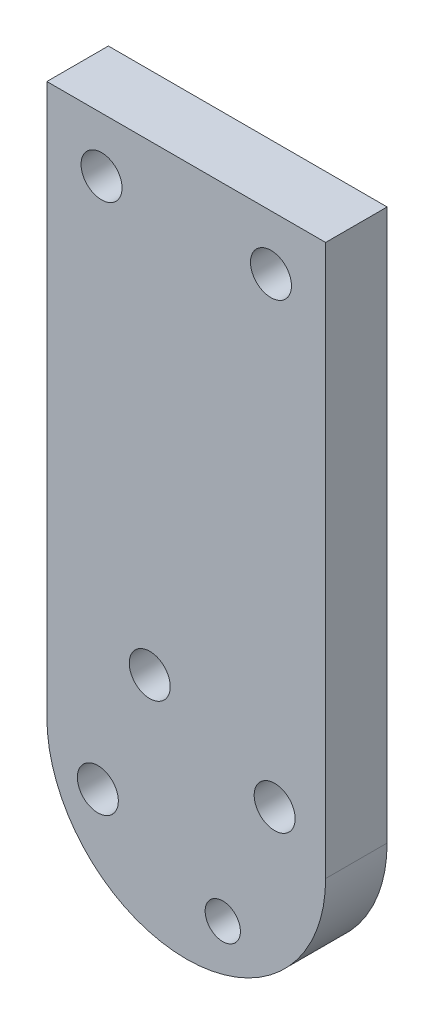
from build123d import *

# Parameters (mm, degrees)
SKETCH1_R           = 1.5
SKETCH1_R_2         = 1.289902994
BOSS_EXTRUDE1_DEPTH = 4.5


with BuildPart() as part:
    # Sketch1 → Boss-Extrude1 (new body)
    # profile 1 of 3: a face of its own
    with BuildSketch(Plane.XY):
        with BuildLine():
            ThreePointArc((-20.4, 0), (-10.2, 10.2), (0, 0))
            Line((0, 0), (0, 40.315274694))
            Line((0, 40.315274694), (-20.4, 40.315274694))
            Line((-20.4, 40.315274694), (-20.4, 0))
        make_face()
        with Locations((-16.4, 36.315274694)):
            Circle(SKETCH1_R, mode=Mode.SUBTRACT)
        with Locations((-4, 36.315274694)):
            Circle(SKETCH1_R, mode=Mode.SUBTRACT)
    # profile 2 of 3: a face of its own
    with BuildSketch(Plane.XY):
        with BuildLine():
            ThreePointArc((-20.4, 0), (-10.2, -10.2), (0, 0))
            Line((0, 0), (-20.4, 0))
        make_face()
        with Locations((-16.670203746, -2.671416008)):
            Circle(SKETCH1_R, mode=Mode.SUBTRACT)
        with Locations((-7.528583992, -6.470203746)):
            Circle(SKETCH1_R_2, mode=Mode.SUBTRACT)
    # profile 3 of 3: a face of its own
    with BuildSketch(Plane.XY):
        with BuildLine():
            Line((-20.4, 0), (0, 0))
            ThreePointArc((0, 0), (-10.2, 10.2), (-20.4, 0))
        make_face()
        with Locations((-12.871416008, 6.470203746)):
            Circle(SKETCH1_R, mode=Mode.SUBTRACT)
        with Locations((-3.729796254, 2.671416008)):
            Circle(SKETCH1_R, mode=Mode.SUBTRACT)
    extrude(amount=BOSS_EXTRUDE1_DEPTH)


solid = part.part
